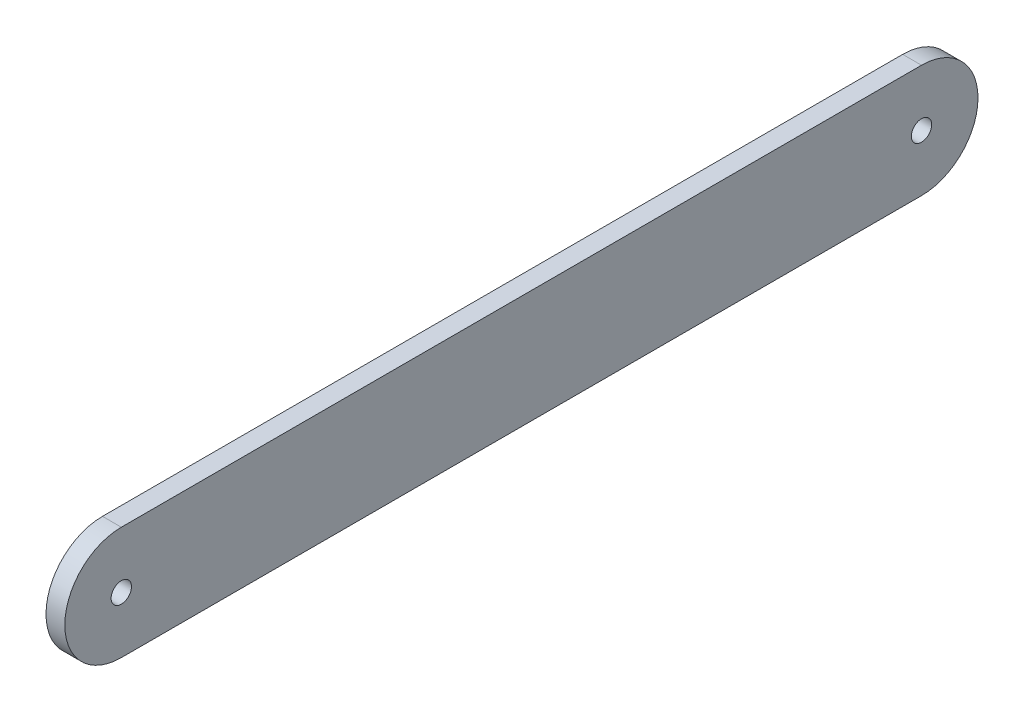
from build123d import *

# Parameters (mm, degrees)
SKETCH1_R           = 2.7
BOSS_EXTRUDE1_DEPTH = 5


with BuildPart() as part:
    # Sketch1 → Boss-Extrude1 (new body)
    with BuildSketch(Plane(origin=(0, 0, 0), x_dir=(0, 0, -1), z_dir=(1, 0, 0))):
        with BuildLine():
            Line((-106.25, -15), (106.25, -15))
            ThreePointArc((106.25, -15), (121.25, 0), (106.25, 15))
            Line((106.25, 15), (-106.25, 15))
            ThreePointArc((-106.25, 15), (-121.25, 0), (-106.25, -15))
        make_face()
        with Locations((-106.25, 0)):
            Circle(SKETCH1_R, mode=Mode.SUBTRACT)
        with Locations((106.25, 0)):
            Circle(SKETCH1_R, mode=Mode.SUBTRACT)
    extrude(amount=BOSS_EXTRUDE1_DEPTH)


solid = part.part
